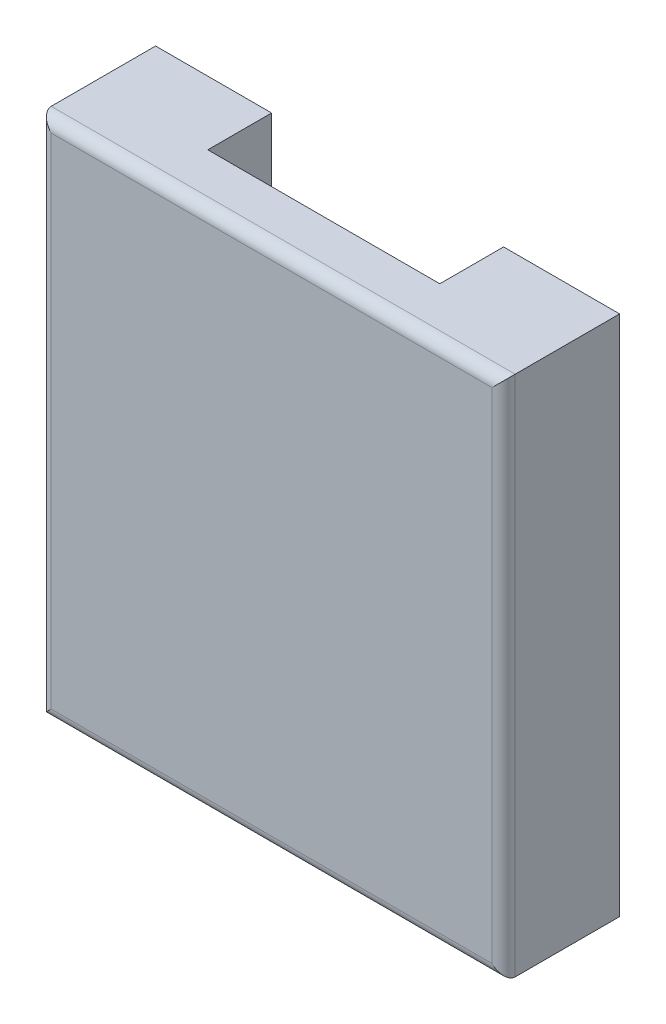
from build123d import *

# Parameters (mm, degrees)
CROQUIS1_W              = 40
CROQUIS1_H              = 45
SALIENTE_EXTRUIR1_DEPTH = 4.5
CROQUIS2_W              = 10
CROQUIS2_H              = 45
SALIENTE_EXTRUIR2_DEPTH = 5.5
REDONDEO1_R             = 1


with BuildPart() as part:
    # Croquis1 → Saliente-Extruir1 (new body)
    with BuildSketch(Plane.XY):
        Rectangle(CROQUIS1_W, CROQUIS1_H)
    extrude(amount=SALIENTE_EXTRUIR1_DEPTH)

    # Croquis2 → Saliente-Extruir2 (add)
    with BuildSketch(Plane(origin=(0, 0, 0), x_dir=(-1, 0, 0), z_dir=(0, 0, -1))):
        with Locations((-15, 0)):
            Rectangle(CROQUIS2_W, CROQUIS2_H)
        with Locations((15, 0)):
            Rectangle(CROQUIS2_W, CROQUIS2_H)
    extrude(amount=SALIENTE_EXTRUIR2_DEPTH)

    # Redondeo1
    redondeo1_edges = [part.edges().sort_by_distance(p)[0] for p in [
        (-20, 0, 4.5),
        (0, -22.5, 4.5),
        (20, 0, 4.5),
        (0, 22.5, 4.5),
    ]]
    fillet(redondeo1_edges, radius=REDONDEO1_R)


solid = part.part
